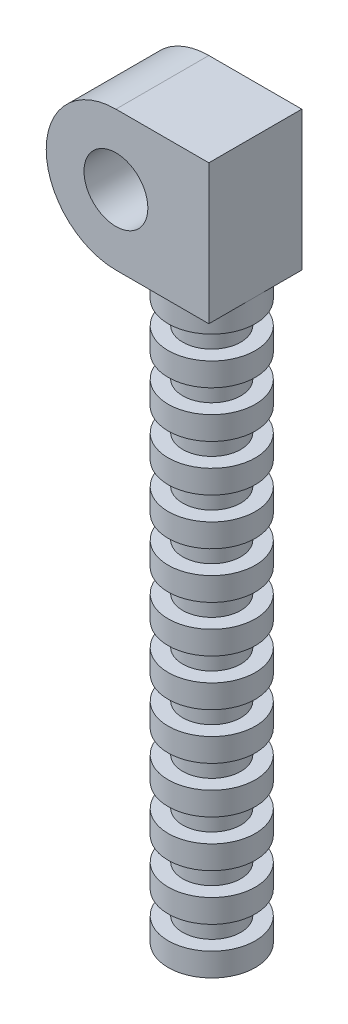
from build123d import *

# Parameters (mm, degrees)
SKETCH1_R               = 0.5
BOSS_EXTRUDE1_DEPTH     = 5
SKETCH7_R               = 0.75
BOSS_EXTRUDE4_DEPTH     = 0.4
LPATTERN10_COUNT        = 13
LPATTERN10_PITCH        = 0.8
BOSS_EXTRUDE5_DEPTH     = 0.8
CUT_EXTRUDE2_DEPTH      = 8.720265539
CUT_EXTRUDE2_DEPTH_BACK = 8.720265539
SKETCH12_R              = 0.55


with BuildPart() as part:
    # Sketch1 → Boss-Extrude1 (new, symmetric)
    with BuildSketch(Plane(origin=(0, 0, 0), x_dir=(1, 0, 0), z_dir=(0, 1, 0))):
        Circle(SKETCH1_R)
    extrude(amount=BOSS_EXTRUDE1_DEPTH, both=True)

    # Sketch7 → Boss-Extrude4 (add)
    with BuildSketch(Plane(origin=(0, 5, 0), x_dir=(1, 0, 0), z_dir=(0, 1, 0))):
        Circle(SKETCH7_R)
    boss_extrude4 = extrude(amount=-BOSS_EXTRUDE4_DEPTH)

    # LPattern10: Boss-Extrude4 ×13
    with Locations(*[(0, -i * LPATTERN10_PITCH, 0) for i in range(1, LPATTERN10_COUNT)]):
        add(boss_extrude4)

    # Sketch10 → Boss-Extrude5 (add, symmetric)
    with BuildSketch(Plane.XY):
        with BuildLine():
            Line((0.75, 5), (-0.85, 5))
            ThreePointArc((-0.85, 5), (-2.05, 6.2), (-0.85, 7.4))
            Line((-0.85, 7.4), (0.75, 7.4))
            Line((0.75, 7.4), (0.75, 5))
        make_face()
    extrude(amount=BOSS_EXTRUDE5_DEPTH, both=True)

    # Sketch12 → Cut-Extrude2 (cut, two sides: drawn at the far end of the back side and taken through both)
    with BuildSketch(Plane.XY.offset(-CUT_EXTRUDE2_DEPTH_BACK)):
        with Locations((-0.85, 6.2)):
            Circle(SKETCH12_R)
    extrude(amount=CUT_EXTRUDE2_DEPTH + CUT_EXTRUDE2_DEPTH_BACK, mode=Mode.SUBTRACT)


solid = part.part
